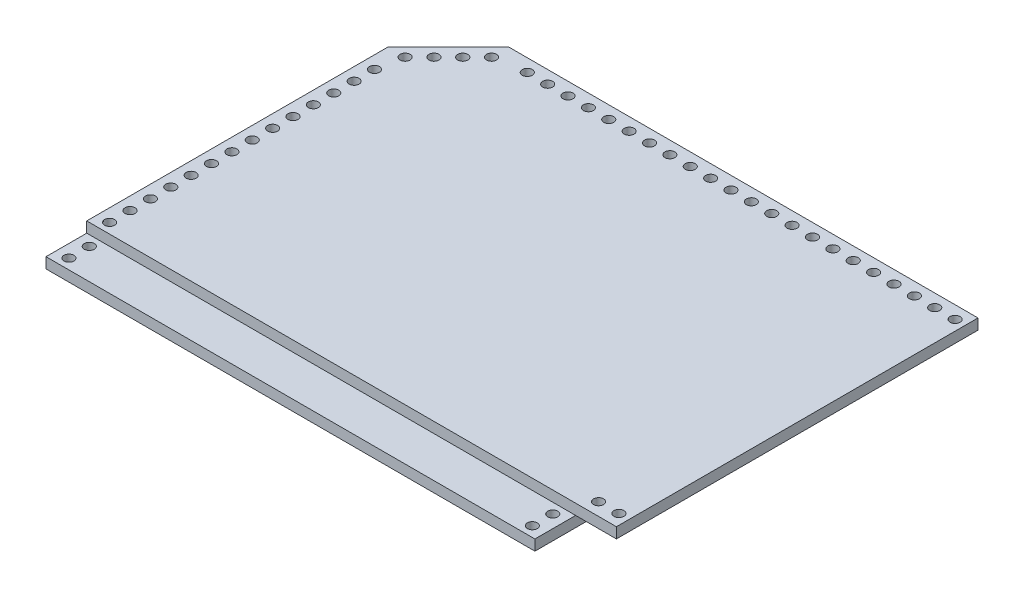
from build123d import *

# Parameters (mm, degrees)
BOSS_EXTRUDE1_DEPTH = 6.35
SKETCH3_R           = 1.5
CUT_EXTRUDE1_DEPTH  = 6.35
LPATTERN2_COUNT     = 22
LPATTERN2_PITCH     = 6.096
SKETCH4_R           = 1.5
CUT_EXTRUDE2_DEPTH  = 6.35
LPATTERN3_COUNT     = 16
LPATTERN3_PITCH     = 6.096
SKETCH6_W           = 120.396
SKETCH6_H           = 3.175
CUT_EXTRUDE3_DEPTH  = 12.192
SKETCH10_W          = 12.192
SKETCH10_H          = 12.192
CUT_EXTRUDE9_DEPTH  = 12.192
SKETCH9_W           = 146.304
SKETCH9_H           = 3.175
CUT_EXTRUDE8_DEPTH  = 12.192
SKETCH11_R          = 1.5
CUT_EXTRUDE10_DEPTH = 6.35
SKETCH13_R          = 1.5
CUT_EXTRUDE12_DEPTH = 6.35


with BuildPart() as part:
    # Sketch2 → Boss-Extrude1 (new body)
    with BuildSketch(Plane(origin=(0, 0, 0), x_dir=(1, 0, 0), z_dir=(0, 1, 0))):
        Polygon((-55.206688966, 44.945004491), (-73.167201208, 26.984492248), (-73.167201208, -75.450995509), (85.328798792, -75.450995509), (85.328798792, 44.945004491), align=None)
    extrude(amount=BOSS_EXTRUDE1_DEPTH)

    # Sketch3 → Cut-Extrude1 (cut)
    with BuildSketch(Plane(origin=(0, 6.35, 0), x_dir=(1, 0, 0), z_dir=(0, 1, 0))):
        with Locations(Location((82.280798792, 41.135004491, 0), (0, 0, 270))):
            Circle(SKETCH3_R)
    cut_extrude1 = extrude(amount=-CUT_EXTRUDE1_DEPTH, mode=Mode.SUBTRACT)

    # LPattern2: Cut-Extrude1 ×22
    with Locations(*[(-i * LPATTERN2_PITCH, 0, 0) for i in range(1, LPATTERN2_COUNT)]):
        add(cut_extrude1, mode=Mode.SUBTRACT)

    # Sketch4 → Cut-Extrude2 (cut)
    with BuildSketch(Plane(origin=(0, 6.35, 0), x_dir=(1, 0, 0), z_dir=(0, 1, 0))):
        with Locations(Location((-69.357201208, -72.402995509, 0), (0, 0, 270))):
            Circle(SKETCH4_R)
    cut_extrude2 = extrude(amount=-CUT_EXTRUDE2_DEPTH, mode=Mode.SUBTRACT)

    # LPattern3: Cut-Extrude2 ×16
    with Locations(*[(0, 0, -i * LPATTERN3_PITCH) for i in range(1, LPATTERN3_COUNT)]):
        add(cut_extrude2, mode=Mode.SUBTRACT)

    # Sketch6 → Cut-Extrude3 (cut)
    with BuildSketch(Plane(origin=(85.328798792, 0, 0), x_dir=(0, 0, -1), z_dir=(1, 0, 0))):
        with Locations((-15.252995509, 1.5875)):
            Rectangle(SKETCH6_W, SKETCH6_H)
    extrude(amount=-CUT_EXTRUDE3_DEPTH, mode=Mode.SUBTRACT)

    # Sketch10 → Cut-Extrude9 (cut)
    with BuildSketch(Plane(origin=(0, 6.35, 0), x_dir=(1, 0, 0), z_dir=(0, 1, 0))):
        with Locations((79.232798792, -69.354995509)):
            Rectangle(SKETCH10_W, SKETCH10_H)
    extrude(amount=-CUT_EXTRUDE9_DEPTH, mode=Mode.SUBTRACT)

    # Sketch9 → Cut-Extrude8 (cut)
    with BuildSketch(Plane.XY.offset(75.450995509)):
        with Locations((-0.015201208, 4.7625)):
            Rectangle(SKETCH9_W, SKETCH9_H)
    extrude(amount=-CUT_EXTRUDE8_DEPTH, mode=Mode.SUBTRACT)

    # Sketch11 → Cut-Extrude10 (cut)
    with BuildSketch(Plane(origin=(0, 6.35, 0), x_dir=(1, 0, 0), z_dir=(0, 1, 0))):
        with Locations(Location((82.280798792, -59.448995509, 0), (0, 0, 270))):
            Circle(SKETCH11_R)
        with Locations(Location((76.184798792, -59.448995509, 0), (0, 0, 270))):
            Circle(SKETCH11_R)
        with Locations(Location((69.326798792, -66.306995509, 0), (0, 0, 270))):
            Circle(SKETCH11_R)
        with Locations(Location((69.326798792, -72.402995509, 0), (0, 0, 270))):
            Circle(SKETCH11_R)
    extrude(amount=-CUT_EXTRUDE10_DEPTH, mode=Mode.SUBTRACT)

    # Sketch13 → Cut-Extrude12 (cut)
    with BuildSketch(Plane(origin=(0, 6.35, 0), x_dir=(1, 0, 0), z_dir=(0, 1, 0))):
        with Locations(Location((-59.337606782, 35.425933002, 0), (0, 0, 270))):
            Circle(SKETCH13_R)
        with Locations(Location((-55.027083843, 39.73645594, 0), (0, 0, 270))):
            Circle(SKETCH13_R)
        with Locations(Location((-63.64812972, 31.115410064, 0), (0, 0, 270))):
            Circle(SKETCH13_R)
        with Locations(Location((-67.958652658, 26.804887126, 0), (0, 0, 270))):
            Circle(SKETCH13_R)
    extrude(amount=-CUT_EXTRUDE12_DEPTH, mode=Mode.SUBTRACT)


solid = part.part
